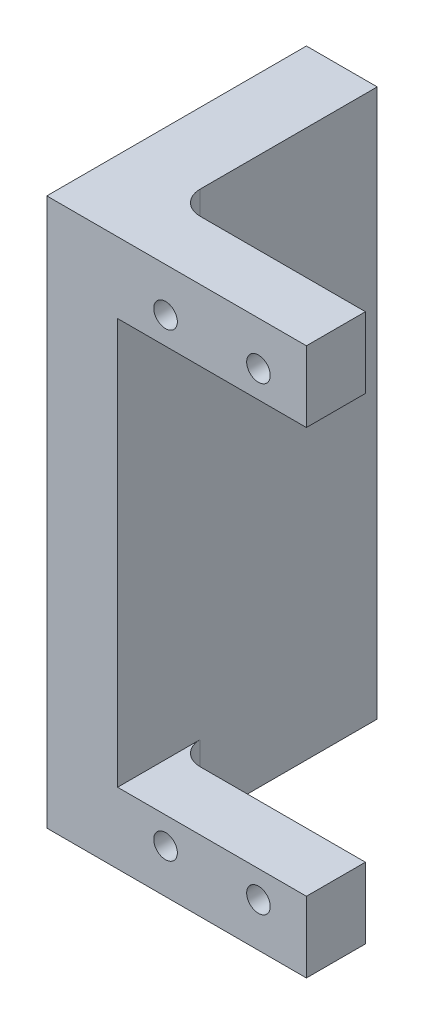
from build123d import *

# Parameters (mm, degrees)
SKETCH1_R           = 1.27
BOSS_EXTRUDE1_DEPTH = 6.35
SKETCH2_W           = 7.62
SKETCH2_H           = 58.928
BOSS_EXTRUDE2_DEPTH = 21.59
SKETCH3_R           = 1.905
BOSS_EXTRUDE3_DEPTH = 3.81
FILLET1_R           = 2.54


with BuildPart() as part:
    # Sketch1 → Boss-Extrude1 (new body)
    with BuildSketch(Plane.XY):
        Polygon((0, 0), (20.32, 0), (20.32, -7.62), (-7.62, -7.62), (-7.62, 51.308), (20.32, 51.308), (20.32, 43.688), (0, 43.688), align=None)
        with Locations((5.16001, 46.59376)):
            Circle(SKETCH1_R, mode=Mode.SUBTRACT)
        with Locations((15.15999, 46.59376)):
            Circle(SKETCH1_R, mode=Mode.SUBTRACT)
        with Locations((5.16001, -2.90576)):
            Circle(SKETCH1_R, mode=Mode.SUBTRACT)
        with Locations((15.15999, -2.90576)):
            Circle(SKETCH1_R, mode=Mode.SUBTRACT)
    extrude(amount=BOSS_EXTRUDE1_DEPTH)

    # Sketch2 → Boss-Extrude2 (add)
    with BuildSketch(Plane(origin=(0, 0, 0), x_dir=(-1, 0, 0), z_dir=(0, 0, -1))):
        with Locations((3.81, 21.844)):
            Rectangle(SKETCH2_W, SKETCH2_H)
    extrude(amount=BOSS_EXTRUDE2_DEPTH)

    # Sketch3 → Boss-Extrude3 (add)
    # profile 1 of 2: a face of its own
    with BuildSketch(Plane(origin=(0, 0, -21.59), x_dir=(-1, 0, 0), z_dir=(0, 0, -1))):
        with BuildLine():
            Line((13.97, 42.799), (7.62, 42.799))
            Line((7.62, 42.799), (7.62, 32.639))
            Line((7.62, 32.639), (13.97, 32.639))
            ThreePointArc((13.97, 32.639), (19.05, 37.719), (13.97, 42.799))
        make_face()
        with Locations((13.97, 37.719)):
            Circle(SKETCH3_R, mode=Mode.SUBTRACT)
    # profile 2 of 2: a face of its own
    with BuildSketch(Plane(origin=(0, 0, -21.59), x_dir=(-1, 0, 0), z_dir=(0, 0, -1))):
        with BuildLine():
            Line((13.97, 11.049), (7.62, 11.049))
            Line((7.62, 11.049), (7.62, 0.889))
            Line((7.62, 0.889), (13.97, 0.889))
            ThreePointArc((13.97, 0.889), (19.05, 5.969), (13.97, 11.049))
        make_face()
        with Locations((13.97, 5.969)):
            Circle(SKETCH3_R, mode=Mode.SUBTRACT)
    extrude(amount=-BOSS_EXTRUDE3_DEPTH)

    # Fillet1
    fillet1_edges = [part.edges().sort_by_distance(p)[0] for p in [
        (0, -3.81, 0),
        (0, 47.498, 0),
        (-7.62, 37.719, -17.78),
        (-7.62, 32.639, -19.685),
        (-7.62, 42.799, -19.685),
        (-7.62, 5.969, -17.78),
        (-7.62, 0.889, -19.685),
        (-7.62, 11.049, -19.685),
    ]]
    fillet(fillet1_edges, radius=FILLET1_R)


solid = part.part
